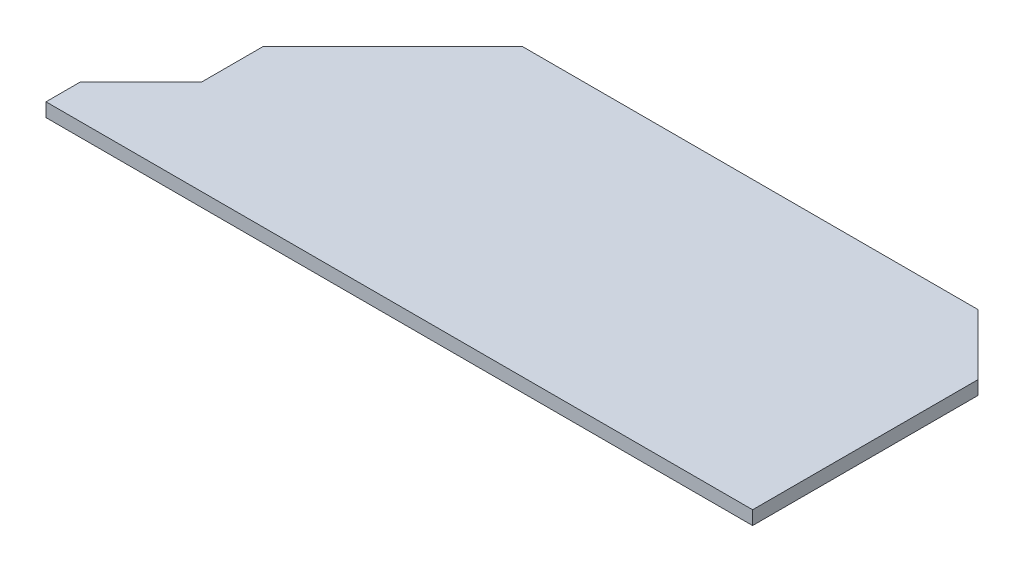
from build123d import *

# Parameters (mm, degrees)
BOSS_EXTRUDE1_DEPTH = 2.4
SKETCH2_W           = 45.055197291
SKETCH2_H           = 7.683409872
BOSS_EXTRUDE2_DEPTH = 2.8


with BuildPart() as part:
    # Sketch1 → Boss-Extrude1 (new body)
    with BuildSketch(Plane(origin=(0, 0, 0), x_dir=(1, 0, 0), z_dir=(0, 1, 0))):
        Polygon((-39.136453838, -29.650568182), (84.363546162, -29.650568182), (84.363546162, 9.7428301), (73.756944444, 20.349431818), (-5.902435122, 20.349431818), (-28.52985212, -2.27798518), (-28.52985212, -13.043966464), (-39.136453838, -23.650568182), align=None)
    extrude(amount=BOSS_EXTRUDE1_DEPTH)

    # Sketch2 → Boss-Extrude2 (add)
    with BuildSketch(Plane(origin=(0, 0, 0), x_dir=(-1, 0, 0), z_dir=(0, -1, 0))):
        with Locations((-28.501851434, -14.034130816)):
            Rectangle(SKETCH2_W, SKETCH2_H)
    extrude(amount=BOSS_EXTRUDE2_DEPTH)


solid = part.part
